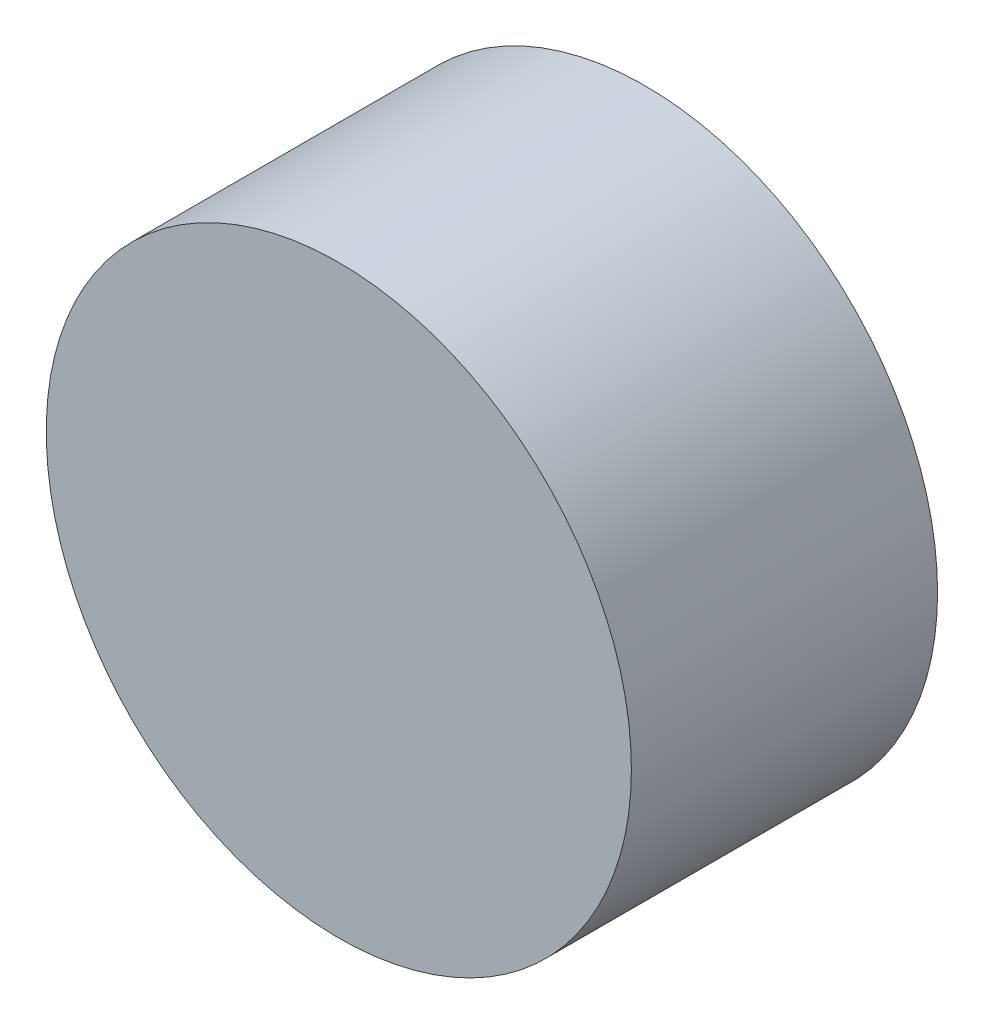
from build123d import *

# Parameters (mm, degrees)
SKETCH1_R           = 43
SKETCH1_R_2         = 27.5
BOSS_EXTRUDE1_DEPTH = 40
SKETCH2_R           = 43
BOSS_EXTRUDE2_DEPTH = 5
BOSS_EXTRUDE3_DEPTH = 10


with BuildPart() as part:
    # Sketch1 → Boss-Extrude1 (new body)
    with BuildSketch(Plane.XY):
        Circle(SKETCH1_R)
        Circle(SKETCH1_R_2, mode=Mode.SUBTRACT)
    extrude(amount=BOSS_EXTRUDE1_DEPTH)

    # Sketch2 → Boss-Extrude2 (add)
    with BuildSketch(Plane.XY.offset(40)):
        Circle(SKETCH2_R)
    extrude(amount=BOSS_EXTRUDE2_DEPTH)

    # Sketch3 → Boss-Extrude3 (add)
    with BuildSketch(Plane(origin=(0, 0, 40), x_dir=(-1, 0, 0), z_dir=(0, 0, -1))):
        Polygon((6.350852961, 11), (-6.350852961, 11), (-12.701705922, 0), (-6.350852961, -11), (6.350852961, -11), (12.701705922, 0), align=None)
        Polygon((3.464101615, 6), (-3.464101615, 6), (-6.92820323, 0), (-3.464101615, -6), (3.464101615, -6), (6.92820323, 0), align=None, mode=Mode.SUBTRACT)
    extrude(amount=BOSS_EXTRUDE3_DEPTH)


solid = part.part
